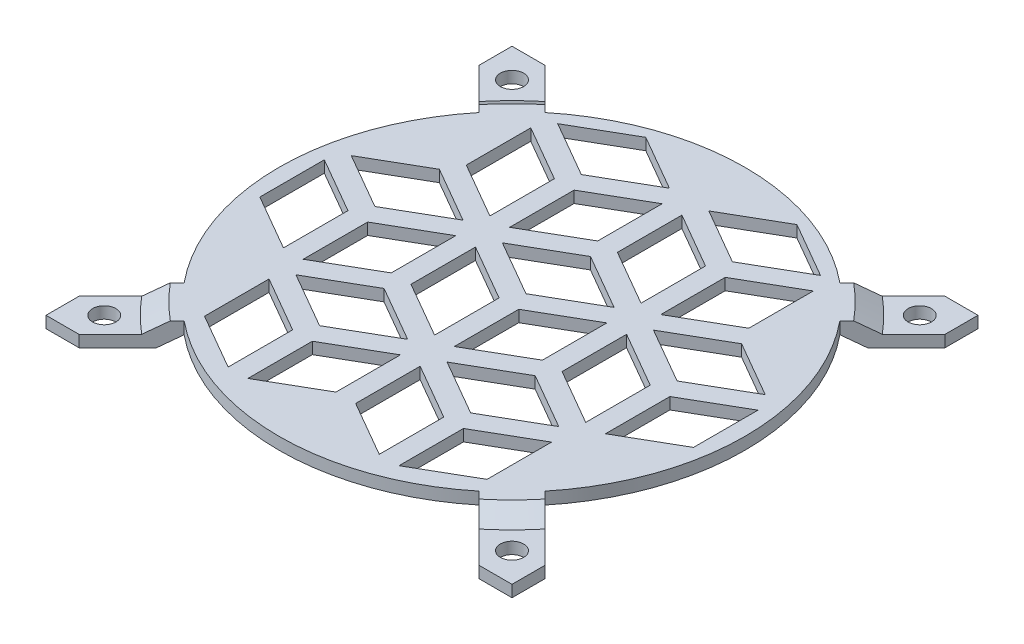
from build123d import *

# Parameters (mm, degrees)
SKETCH_1_R          = 3
EXTRUDE_1_DEPTH     = 6
SKETCH_2_R          = 65
CUT_EXTRUDE_1_DEPTH = 3
CUT_EXTRUDE_1_DRAFT = -60
SKETCH_3_OUTSIDE_W  = 166.354
SKETCH_3_OUTSIDE_H  = 166.354
SKETCH_3_OUTSIDE_R  = 62.5
CUT_EXTRUDE_2_DEPTH = 3
CUT_EXTRUDE_2_DRAFT = -60
CUT_EXTRUDE1_DEPTH  = 86.064681421


with BuildPart() as part:
    # Эскиз1 → Бобышка-Вытянуть1 (new body)
    with BuildSketch(Plane(origin=(0, 0, 0), x_dir=(1, 0, 0), z_dir=(0, 1, 0))):
        with BuildLine():
            Line((-51.514718626, -60), (-37.971101151, -46.456382526))
            ThreePointArc((-37.971101151, -46.456382526), (0, -60), (37.971101151, -46.456382526))
            Line((37.971101151, -46.456382526), (51.514718626, -60))
            Line((51.514718626, -60), (60, -60))
            Line((60, -60), (60, -51.514718626))
            Line((60, -51.514718626), (46.456382526, -37.971101151))
            ThreePointArc((46.456382526, -37.971101151), (60, 0), (46.456382526, 37.971101151))
            Line((46.456382526, 37.971101151), (60, 51.514718626))
            Line((60, 51.514718626), (60, 60))
            Line((60, 60), (51.514718626, 60))
            Line((51.514718626, 60), (37.971101151, 46.456382526))
            ThreePointArc((37.971101151, 46.456382526), (0, 60), (-37.971101151, 46.456382526))
            Line((-37.971101151, 46.456382526), (-51.514718626, 60))
            Line((-51.514718626, 60), (-60, 60))
            Line((-60, 60), (-60, 51.514718626))
            Line((-60, 51.514718626), (-46.456382526, 37.971101151))
            ThreePointArc((-46.456382526, 37.971101151), (-60, 0), (-46.456382526, -37.971101151))
            Line((-46.456382526, -37.971101151), (-60, -51.514718626))
            Line((-60, -51.514718626), (-60, -60))
            Line((-60, -60), (-51.514718626, -60))
        make_face()
        with Locations(Location((-52.5, -52.5, 0), (0, 0, 270))):
            Circle(SKETCH_1_R, mode=Mode.SUBTRACT)
        with Locations(Location((-52.5, 52.5, 0), (0, 0, 270))):
            Circle(SKETCH_1_R, mode=Mode.SUBTRACT)
        with Locations(Location((52.5, 52.5, 0), (0, 0, 270))):
            Circle(SKETCH_1_R, mode=Mode.SUBTRACT)
        with Locations(Location((52.5, -52.5, 0), (0, 0, 270))):
            Circle(SKETCH_1_R, mode=Mode.SUBTRACT)
        with BuildLine():
            Line((2.73923518, 6.981875867), (6.459180807, 10.701821494))
            ThreePointArc((6.459180807, 10.701821494), (0, 12.5), (-6.459180807, 10.701821494))
            Line((-6.459180807, 10.701821494), (-2.73923518, 6.981875867))
            ThreePointArc((-2.73923518, 6.981875867), (0, 7.5), (2.73923518, 6.981875867))
        make_face(mode=Mode.SUBTRACT)
    extrude(amount=EXTRUDE_1_DEPTH)


with BuildPart() as cut_extrude_1_tool:
    # Эскиз2 → Вырез-Вытянуть1 (with draft: the straight prism first)
    with BuildSketch(Plane.XZ):
        Circle(SKETCH_2_R)
    extrude(amount=-CUT_EXTRUDE_1_DEPTH)
    # Вырез-Вытянуть1: the draft: its side faces are tilted about the plane it starts from
    cut_extrude_1_sides = [cut_extrude_1_tool.faces().sort_by_distance(p)[0] for p in [
        (-65, 1.5, 0),
    ]]
    draft(cut_extrude_1_sides, Plane.XZ, CUT_EXTRUDE_1_DRAFT)


with BuildPart() as part_1:
    add(part.part)

    # Вырез-Вытянуть1: cut by cut_extrude_1_tool
    add(cut_extrude_1_tool.part, mode=Mode.SUBTRACT)


with BuildPart() as cut_extrude_2_tool:
    # Эскиз3 outside → Вырез-Вытянуть2 (with draft: the straight prism first)
    with BuildSketch(Plane(origin=(0, 6, 0), x_dir=(1, 0, 0), z_dir=(0, 1, 0))):
        Rectangle(SKETCH_3_OUTSIDE_W, SKETCH_3_OUTSIDE_H)
        Circle(SKETCH_3_OUTSIDE_R, mode=Mode.SUBTRACT)
    extrude(amount=-CUT_EXTRUDE_2_DEPTH)
    # Вырез-Вытянуть2: the draft: its side faces are tilted about the plane it starts from
    cut_extrude_2_sides = [cut_extrude_2_tool.faces().sort_by_distance(p)[0] for p in [
        (0, 4.5, 83.177),
        (83.177, 4.5, 0),
        (0, 4.5, -83.177),
        (-83.177, 4.5, 0),
        (-62.5, 4.5, 0),
    ]]
    draft(cut_extrude_2_sides, Plane(origin=(0, 6, 0), x_dir=(1, 0, 0), z_dir=(0, 1, 0)), CUT_EXTRUDE_2_DRAFT)


with BuildPart() as part_2:
    add(part_1.part)

    # Вырез-Вытянуть2: cut by cut_extrude_2_tool
    add(cut_extrude_2_tool.part, mode=Mode.SUBTRACT)

    # Sketch1 → Cut-Extrude1 (cut, through all)
    with BuildSketch(Plane(origin=(0, 6, 0), x_dir=(1, 0, 0), z_dir=(0, 1, 0))):
        Polygon((19.45563956, 53.914075196), (5.07363956, 45.610623625), (19.45563956, 37.307172053), (33.83763956, 45.610623625), align=None)
        Polygon((2.53563956, 41.214678675), (2.53563956, 24.607775532), (16.91763956, 16.30432396), (16.91763956, 32.911227103), align=None)
        Polygon((21.99363956, 16.30432396), (36.37563956, 24.607775532), (36.37563956, 41.214678675), (21.99363956, 32.911227103), align=None)
        Polygon((-19.46036044, 53.914075196), (-33.84236044, 45.610623625), (-19.46036044, 37.307172053), (-5.07836044, 45.610623625), align=None)
        Polygon((-36.38036044, 41.214678675), (-36.38036044, 24.607775532), (-21.99836044, 16.30432396), (-21.99836044, 32.911227103), align=None)
        Polygon((-16.92236044, 16.30432396), (-2.54036044, 24.607775532), (-2.54036044, 41.214678675), (-16.92236044, 32.911227103), align=None)
        Polygon((38.91363956, 20.211830582), (24.53163956, 11.908379011), (38.91363956, 3.604927439), (53.29563956, 11.908379011), align=None)
        Polygon((21.99363956, 7.512434061), (21.99363956, -9.094469082), (36.37563956, -17.397920653), (36.37563956, -0.79101751), align=None)
        Polygon((41.45163956, -17.397920653), (55.83363956, -9.094469082), (55.83363956, 7.512434061), (41.45163956, -0.79101751), align=None)
        Polygon((-2.54036044, -42.796713695), (-16.92236044, -51.100165267), (-16.92236044, -34.493262124), (-2.54036044, -26.189810552), align=None)
        Polygon((19.45563956, -13.490414031), (5.07363956, -21.793865603), (19.45563956, -30.097317174), (33.83763956, -21.793865603), align=None)
        Polygon((2.53563956, -26.189810552), (2.53563956, -42.796713695), (16.91763956, -51.100165267), (16.91763956, -34.493262124), align=None)
        Polygon((21.99363956, -51.100165267), (36.37563956, -42.796713695), (36.37563956, -26.189810552), (21.99363956, -34.493262124), align=None)
        Polygon((-19.46036044, -13.490414031), (-33.84236044, -21.793865603), (-19.46036044, -30.097317174), (-5.07836044, -21.793865603), align=None)
        Polygon((-36.38036044, -26.189810552), (-36.38036044, -42.796713695), (-21.99836044, -51.100165267), (-21.99836044, -34.493262124), align=None)
        Polygon((-21.99836044, -9.094469082), (-36.38036044, -17.397920653), (-36.38036044, -0.79101751), (-21.99836044, 7.512434061), align=None)
        Polygon((-0.00236044, 20.211830582), (-14.38436044, 11.908379011), (-0.00236044, 3.604927439), (14.37963956, 11.908379011), align=None)
        Polygon((-16.92236044, 7.512434061), (-16.92236044, -9.094469082), (-2.54036044, -17.397920653), (-2.54036044, -0.79101751), align=None)
        Polygon((2.53563956, -17.397920653), (16.91763956, -9.094469082), (16.91763956, 7.512434061), (2.53563956, -0.79101751), align=None)
        Polygon((-38.91836044, 20.211830582), (-53.30036044, 11.908379011), (-38.91836044, 3.604927439), (-24.53636044, 11.908379011), align=None)
        Polygon((-55.83836044, 7.512434061), (-55.83836044, -9.094469082), (-41.45636044, -17.397920653), (-41.45636044, -0.79101751), align=None)
    extrude(amount=-CUT_EXTRUDE1_DEPTH, mode=Mode.SUBTRACT)


solid = part_2.part
